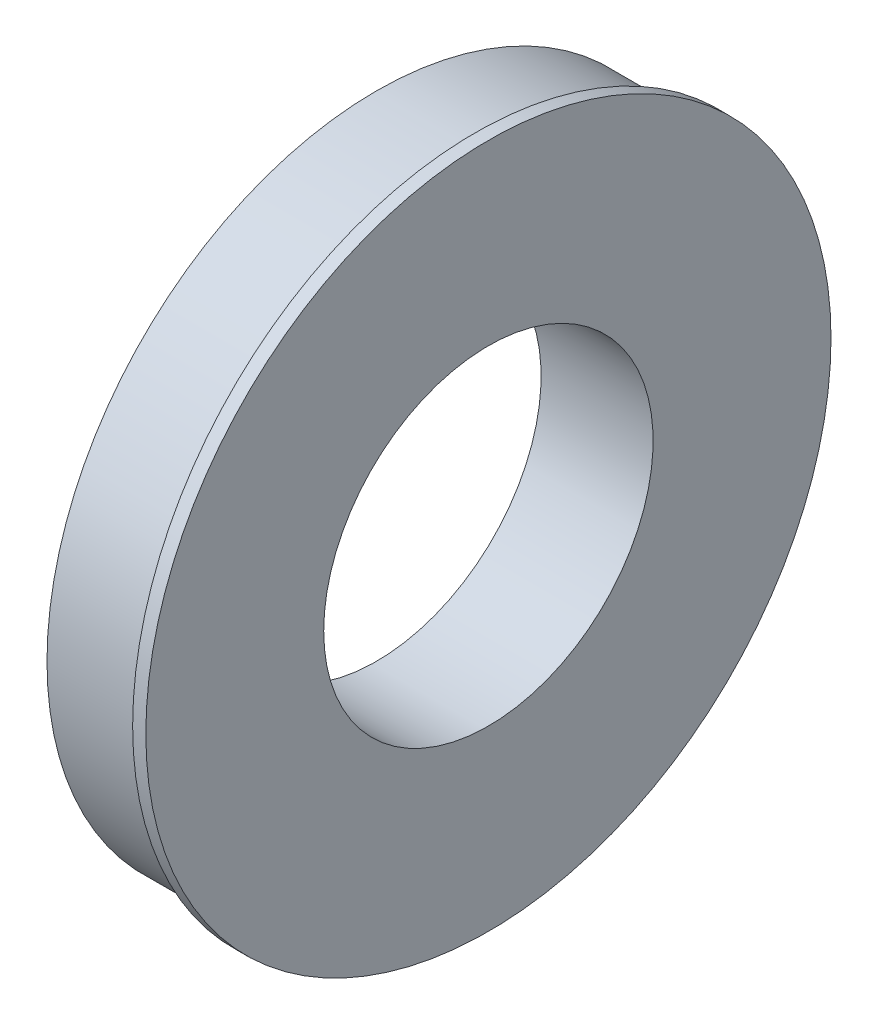
from build123d import *

# Parameters (mm, degrees)
SKETCH1_R           = 63.5
SKETCH1_R_2         = 31.75
BOSS_EXTRUDE1_DEPTH = 19.05
SKETCH2_R           = 66.04
SKETCH2_R_2         = 31.75
BOSS_EXTRUDE2_DEPTH = 2.54


with BuildPart() as part:
    # Sketch1 → Boss-Extrude1 (new body)
    with BuildSketch(Plane(origin=(0, 0, 0), x_dir=(0, 0, -1), z_dir=(1, 0, 0))):
        with Locations(Location((0, 0, 0), (0, 0, 180))):
            Circle(SKETCH1_R)
        with Locations(Location((0, 0, 0), (0, 0, 180))):
            Circle(SKETCH1_R_2, mode=Mode.SUBTRACT)
    extrude(amount=BOSS_EXTRUDE1_DEPTH)

    # Sketch2 → Boss-Extrude2 (add)
    with BuildSketch(Plane(origin=(19.05, 0, 0), x_dir=(0, 0, -1), z_dir=(1, 0, 0))):
        Circle(SKETCH2_R)
        with Locations(Location((0, 0, 0), (0, 0, 180))):
            Circle(SKETCH2_R_2, mode=Mode.SUBTRACT)
    extrude(amount=BOSS_EXTRUDE2_DEPTH)


solid = part.part
